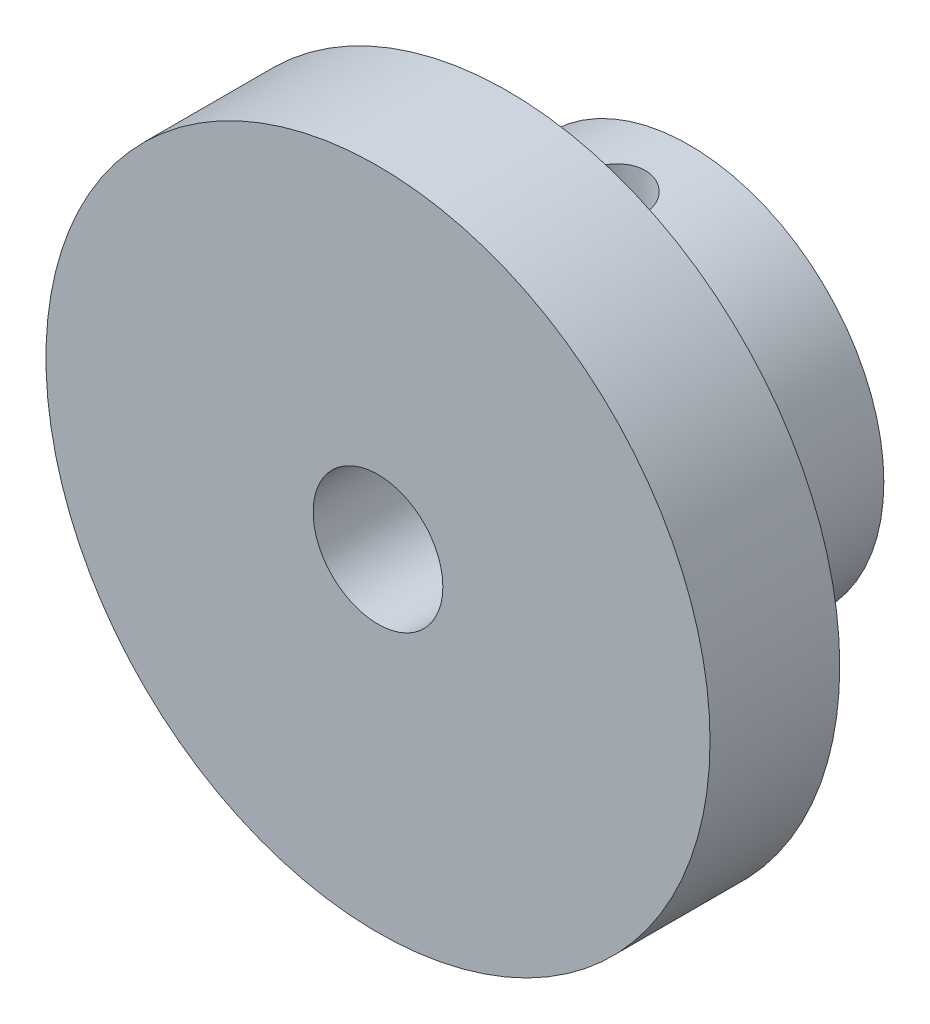
from build123d import *

# Parameters (mm, degrees)
SKETCH1_R                        = 7.5
BOSS_EXTRUDE1_DEPTH              = 7
SKETCH2_R                        = 12.8
BOSS_EXTRUDE2_DEPTH              = 5
SKETCH3_R                        = 2.5
CUT_EXTRUDE1_DEPTH               = 22.718195137
TAP_DRILL_FOR_M3X0_5_TAP1_REACH  = 27.631
TAP_DRILL_FOR_M3X0_5_TAP1_BORE_R = 1.3


with BuildPart() as part:
    # Sketch1 → Boss-Extrude1 (new body)
    with BuildSketch(Plane.XY):
        Circle(SKETCH1_R)
    extrude(amount=BOSS_EXTRUDE1_DEPTH)

    # Sketch2 → Boss-Extrude2 (add)
    with BuildSketch(Plane.XY.offset(7)):
        Circle(SKETCH2_R)
    extrude(amount=BOSS_EXTRUDE2_DEPTH)

    # Sketch3 → Cut-Extrude1 (cut, through all)
    with BuildSketch(Plane.XY.offset(12)):
        Circle(SKETCH3_R)
    extrude(amount=-CUT_EXTRUDE1_DEPTH, mode=Mode.SUBTRACT)

    # Tap Drill for M3x0.5 Tap1 bore (on position points) → Tap Drill for M3x0.5 Tap1 (cut, up to next)
    with BuildSketch(Plane(origin=(0, 7.5, 3), x_dir=(1, 0, 0), z_dir=(0, 1, 0)), mode=Mode.PRIVATE) as tap_drill_for_m3x0_5_tap1_sk1:
        Circle(TAP_DRILL_FOR_M3X0_5_TAP1_BORE_R)
    tap_drill_for_m3x0_5_tap1_tool1 = extrude(tap_drill_for_m3x0_5_tap1_sk1.sketch, amount=-TAP_DRILL_FOR_M3X0_5_TAP1_REACH, mode=Mode.PRIVATE) & part.part
    add(tap_drill_for_m3x0_5_tap1_tool1.solids().sort_by_distance((0, 7.5, 3))[0], mode=Mode.SUBTRACT)


solid = part.part
